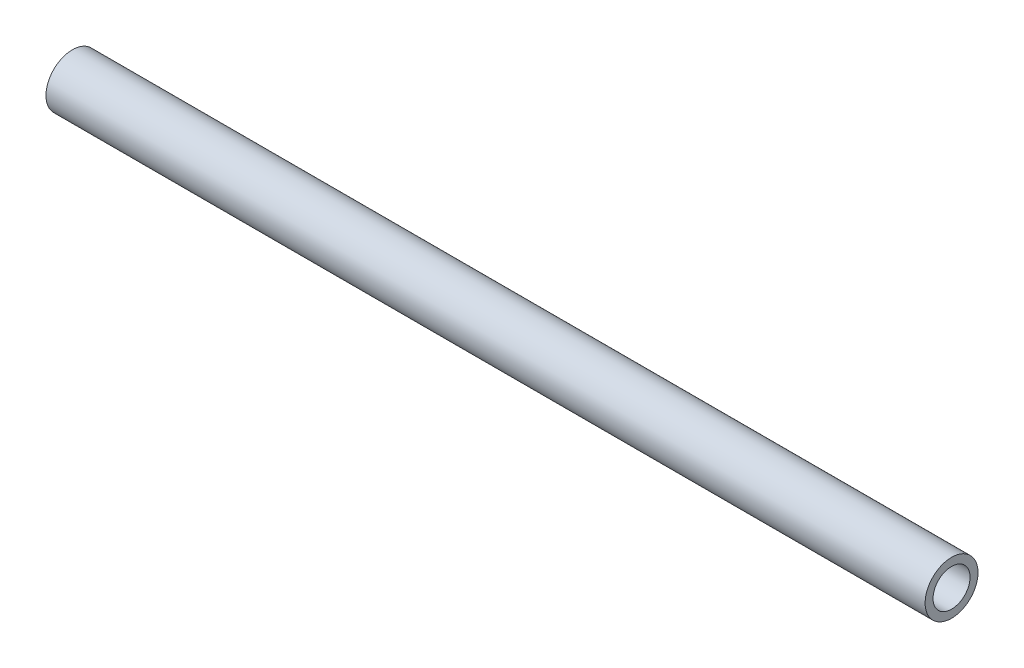
from build123d import *

# Parameters (mm, degrees)
SKETCH1_W = 332.42703798
SKETCH1_H = 3


with BuildPart() as part:
    # Sketch1 → Revolve1 (revolve)
    with BuildSketch(Plane.XY, mode=Mode.PRIVATE) as revolve1_sk:
        with Locations((0, 8.5)):
            Rectangle(SKETCH1_W, SKETCH1_H)
    revolve(revolve1_sk.sketch.rotate(Axis((265.225, 0, 0), (-1, 0, 0)), 90), axis=Axis((265.225, 0, 0), (-1, 0, 0)))


solid = part.part
